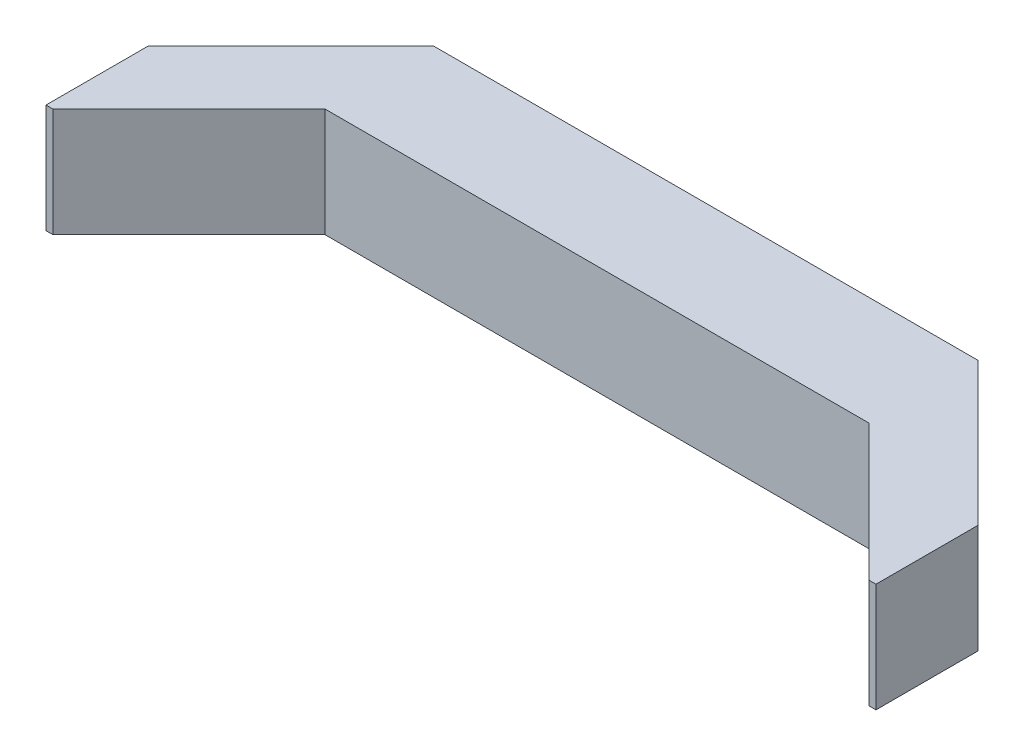
from build123d import *

# Parameters (mm, degrees)
SKETCH1_W           = 2032
SKETCH1_H           = 406.4
BOSS_EXTRUDE1_DEPTH = 406.4
BOSS_EXTRUDE2_DEPTH = 406.4


with BuildPart() as part:
    # Sketch1 → Boss-Extrude1 (new body)
    with BuildSketch(Plane.XY):
        with Locations((1016, 203.2)):
            Rectangle(SKETCH1_W, SKETCH1_H)
    extrude(amount=BOSS_EXTRUDE1_DEPTH)

    # Sketch8 → Boss-Extrude2 (add)
    with BuildSketch(Plane(origin=(0, 406.4, 0), x_dir=(1, 0, 0), z_dir=(0, 1, 0))):
        Polygon((0, -406.4), (-508, -914.4), (-533.4, -914.4), (-533.4, -533.4), (0, 0), align=None)
    boss_extrude2 = extrude(amount=-BOSS_EXTRUDE2_DEPTH)

    # Mirror1: Boss-Extrude2 across plane
    add(boss_extrude2.mirror(Plane(origin=(1016, 0, 0), x_dir=(0, 0, 1), z_dir=(1, 0, 0))))


solid = part.part
